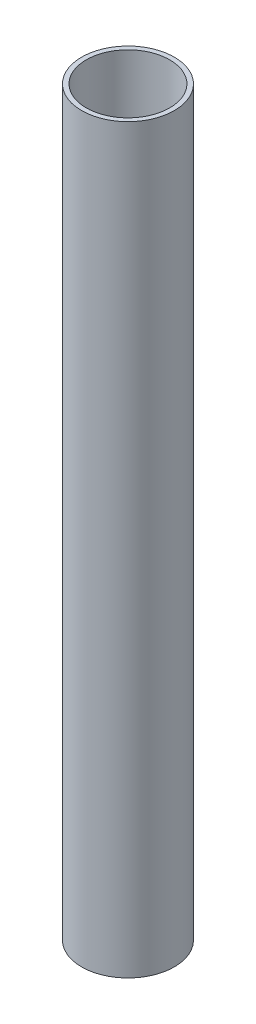
from build123d import *

# Parameters (mm, degrees)
SKETCH_1_R     = 10
SKETCH_1_R_2   = 9
F_1MM_30_DEPTH = 80


with BuildPart() as part:
    # 草图1 → 1mm*30 (new, symmetric)
    with BuildSketch(Plane(origin=(0, 0, 0), x_dir=(1, 0, 0), z_dir=(0, 1, 0))):
        Circle(SKETCH_1_R)
        Circle(SKETCH_1_R_2, mode=Mode.SUBTRACT)
    extrude(amount=F_1MM_30_DEPTH, both=True)


solid = part.part
